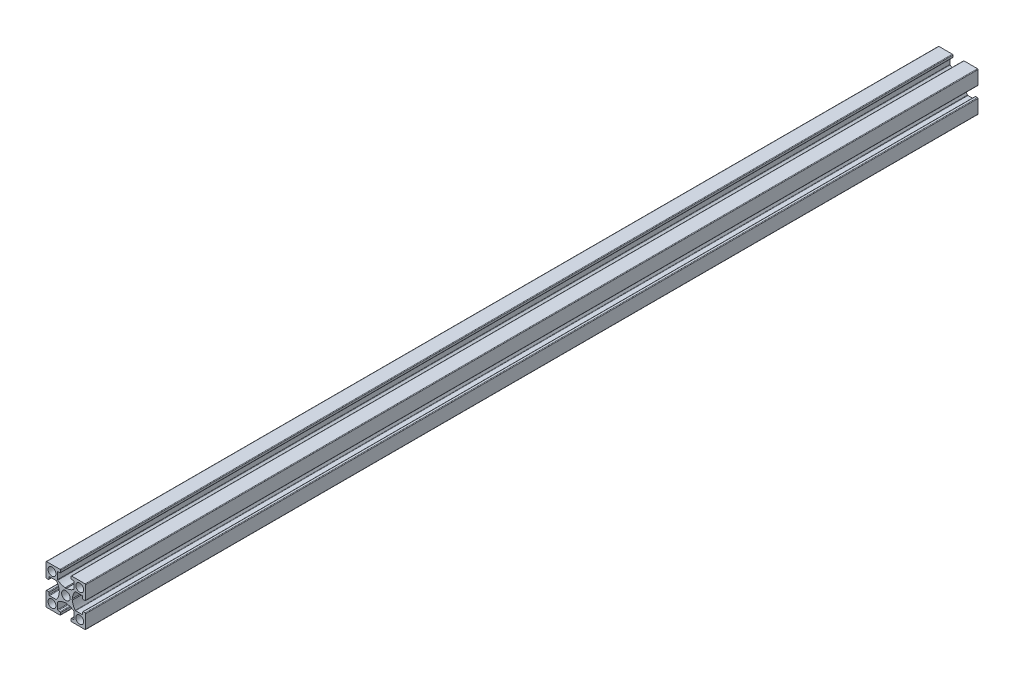
from build123d import *

# Parameters (mm, degrees)
MODEL_R         = 2.15
MODEL_R_2       = 2
EXTRUDE_1_DEPTH = 450


with BuildPart() as part:
    # Model → 보스-돌출1 (new body)
    with BuildSketch(Plane.XY):
        with BuildLine():
            Line((2307.763927197, 1192.134297913), (2307.763927197, 1195.391548465))
            ThreePointArc((2307.763927197, 1195.391548465), (2307.676059232, 1195.603680499), (2307.463927197, 1195.691548465))
            Line((2307.463927197, 1195.691548465), (2306.563927197, 1195.691548465))
            ThreePointArc((2306.563927197, 1195.691548465), (2306.351795163, 1195.779416431), (2306.263927197, 1195.991548465))
            Line((2306.263927197, 1195.991548465), (2306.263927197, 1196.891548465))
            ThreePointArc((2306.263927197, 1196.891548465), (2306.351795163, 1197.103680499), (2306.563927197, 1197.191548465))
            Line((2306.563927197, 1197.191548465), (2313.313927197, 1197.191548465))
            ThreePointArc((2313.313927197, 1197.191548465), (2313.526059232, 1197.103680499), (2313.613927197, 1196.891548465))
            Line((2313.613927197, 1196.891548465), (2313.613927197, 1190.141548465))
            ThreePointArc((2313.613927197, 1190.141548465), (2313.526059232, 1189.929416431), (2313.313927197, 1189.841548465))
            Line((2313.313927197, 1189.841548465), (2312.413927197, 1189.841548465))
            ThreePointArc((2312.413927197, 1189.841548465), (2312.201795163, 1189.929416431), (2312.113927197, 1190.141548465))
            Line((2312.113927197, 1190.141548465), (2312.113927197, 1191.041548465))
            ThreePointArc((2312.113927197, 1191.041548465), (2312.026059232, 1191.253680499), (2311.813927197, 1191.341548465))
            Line((2311.813927197, 1191.341548465), (2308.556676645, 1191.341548465))
            ThreePointArc((2308.556676645, 1191.341548465), (2308.426234796, 1191.311705686), (2308.321744595, 1191.228114625))
            ThreePointArc((2308.321744595, 1191.228114625), (2307.328306374, 1189.47356999), (2306.921204563, 1187.498825831))
            Line((2306.921204563, 1187.498825831), (2306.613927197, 1187.191548465))
            Line((2306.613927197, 1187.191548465), (2306.921204563, 1186.884271099))
            ThreePointArc((2306.921204563, 1186.884271099), (2307.328306374, 1184.90952694), (2308.321744595, 1183.154982305))
            ThreePointArc((2308.321744595, 1183.154982305), (2308.426234796, 1183.071391244), (2308.556676645, 1183.041548465))
            Line((2308.556676645, 1183.041548465), (2311.813927197, 1183.041548465))
            ThreePointArc((2311.813927197, 1183.041548465), (2312.026059232, 1183.129416431), (2312.113927197, 1183.341548465))
            Line((2312.113927197, 1183.341548465), (2312.113927197, 1184.241548465))
            ThreePointArc((2312.113927197, 1184.241548465), (2312.201795163, 1184.453680499), (2312.413927197, 1184.541548465))
            Line((2312.413927197, 1184.541548465), (2313.313927197, 1184.541548465))
            ThreePointArc((2313.313927197, 1184.541548465), (2313.526059232, 1184.453680499), (2313.613927197, 1184.241548465))
            Line((2313.613927197, 1184.241548465), (2313.613927197, 1177.491548465))
            ThreePointArc((2313.613927197, 1177.491548465), (2313.526059232, 1177.279416431), (2313.313927197, 1177.191548465))
            Line((2313.313927197, 1177.191548465), (2306.563927197, 1177.191548465))
            ThreePointArc((2306.563927197, 1177.191548465), (2306.351795163, 1177.279416431), (2306.263927197, 1177.491548465))
            Line((2306.263927197, 1177.491548465), (2306.263927197, 1178.391548465))
            ThreePointArc((2306.263927197, 1178.391548465), (2306.351795163, 1178.603680499), (2306.563927197, 1178.691548465))
            Line((2306.563927197, 1178.691548465), (2307.463927197, 1178.691548465))
            ThreePointArc((2307.463927197, 1178.691548465), (2307.676059232, 1178.779416431), (2307.763927197, 1178.991548465))
            Line((2307.763927197, 1178.991548465), (2307.763927197, 1182.248799017))
            ThreePointArc((2307.763927197, 1182.248799017), (2307.734084418, 1182.379240866), (2307.650493357, 1182.483731067))
            ThreePointArc((2307.650493357, 1182.483731067), (2305.895948722, 1183.477169289), (2303.921204563, 1183.884271099))
            Line((2303.921204563, 1183.884271099), (2303.613927197, 1184.191548465))
            Line((2303.613927197, 1184.191548465), (2303.306649831, 1183.884271099))
            ThreePointArc((2303.306649831, 1183.884271099), (2301.331905673, 1183.477169289), (2299.577361038, 1182.483731067))
            ThreePointArc((2299.577361038, 1182.483731067), (2299.493769977, 1182.379240866), (2299.463927197, 1182.248799017))
            Line((2299.463927197, 1182.248799017), (2299.463927197, 1178.991548465))
            ThreePointArc((2299.463927197, 1178.991548465), (2299.551795163, 1178.779416431), (2299.763927197, 1178.691548465))
            Line((2299.763927197, 1178.691548465), (2300.663927197, 1178.691548465))
            ThreePointArc((2300.663927197, 1178.691548465), (2300.876059232, 1178.603680499), (2300.963927197, 1178.391548465))
            Line((2300.963927197, 1178.391548465), (2300.963927197, 1177.491548465))
            ThreePointArc((2300.963927197, 1177.491548465), (2300.876059232, 1177.279416431), (2300.663927197, 1177.191548465))
            Line((2300.663927197, 1177.191548465), (2293.913927197, 1177.191548465))
            ThreePointArc((2293.913927197, 1177.191548465), (2293.701795163, 1177.279416431), (2293.613927197, 1177.491548465))
            Line((2293.613927197, 1177.491548465), (2293.613927197, 1184.241548465))
            ThreePointArc((2293.613927197, 1184.241548465), (2293.701795163, 1184.453680499), (2293.913927197, 1184.541548465))
            Line((2293.913927197, 1184.541548465), (2294.813927197, 1184.541548465))
            ThreePointArc((2294.813927197, 1184.541548465), (2295.026059232, 1184.453680499), (2295.113927197, 1184.241548465))
            Line((2295.113927197, 1184.241548465), (2295.113927197, 1183.341548465))
            ThreePointArc((2295.113927197, 1183.341548465), (2295.201795163, 1183.129416431), (2295.413927197, 1183.041548465))
            Line((2295.413927197, 1183.041548465), (2298.671177749, 1183.041548465))
            ThreePointArc((2298.671177749, 1183.041548465), (2298.801619599, 1183.071391244), (2298.906109799, 1183.154982305))
            ThreePointArc((2298.906109799, 1183.154982305), (2299.899548021, 1184.90952694), (2300.306649831, 1186.884271099))
            Line((2300.306649831, 1186.884271099), (2300.613927197, 1187.191548465))
            Line((2300.613927197, 1187.191548465), (2300.306649831, 1187.498825831))
            ThreePointArc((2300.306649831, 1187.498825831), (2299.899548021, 1189.47356999), (2298.906109799, 1191.228114625))
            ThreePointArc((2298.906109799, 1191.228114625), (2298.801619599, 1191.311705686), (2298.671177749, 1191.341548465))
            Line((2298.671177749, 1191.341548465), (2295.413927197, 1191.341548465))
            ThreePointArc((2295.413927197, 1191.341548465), (2295.201795163, 1191.253680499), (2295.113927197, 1191.041548465))
            Line((2295.113927197, 1191.041548465), (2295.113927197, 1190.141548465))
            ThreePointArc((2295.113927197, 1190.141548465), (2295.026059232, 1189.929416431), (2294.813927197, 1189.841548465))
            Line((2294.813927197, 1189.841548465), (2293.913927197, 1189.841548465))
            ThreePointArc((2293.913927197, 1189.841548465), (2293.701795163, 1189.929416431), (2293.613927197, 1190.141548465))
            Line((2293.613927197, 1190.141548465), (2293.613927197, 1196.891548465))
            ThreePointArc((2293.613927197, 1196.891548465), (2293.701795163, 1197.103680499), (2293.913927197, 1197.191548465))
            Line((2293.913927197, 1197.191548465), (2300.663927197, 1197.191548465))
            ThreePointArc((2300.663927197, 1197.191548465), (2300.876059232, 1197.103680499), (2300.963927197, 1196.891548465))
            Line((2300.963927197, 1196.891548465), (2300.963927197, 1195.991548465))
            ThreePointArc((2300.963927197, 1195.991548465), (2300.876059232, 1195.779416431), (2300.663927197, 1195.691548465))
            Line((2300.663927197, 1195.691548465), (2299.763927197, 1195.691548465))
            ThreePointArc((2299.763927197, 1195.691548465), (2299.551795163, 1195.603680499), (2299.463927197, 1195.391548465))
            Line((2299.463927197, 1195.391548465), (2299.463927197, 1192.134297913))
            ThreePointArc((2299.463927197, 1192.134297913), (2299.493769977, 1192.003856063), (2299.577361038, 1191.899365863))
            ThreePointArc((2299.577361038, 1191.899365863), (2301.331905673, 1190.905927641), (2303.306649831, 1190.498825831))
            Line((2303.306649831, 1190.498825831), (2303.613927197, 1190.191548465))
            Line((2303.613927197, 1190.191548465), (2303.921204563, 1190.498825831))
            ThreePointArc((2303.921204563, 1190.498825831), (2305.895948722, 1190.905927641), (2307.650493357, 1191.899365863))
            ThreePointArc((2307.650493357, 1191.899365863), (2307.734084418, 1192.003856063), (2307.763927197, 1192.134297913))
        make_face()
        with Locations((2303.613927197, 1187.191548465)):
            Circle(MODEL_R, mode=Mode.SUBTRACT)
        with Locations((2296.613927197, 1194.191548465)):
            Circle(MODEL_R_2, mode=Mode.SUBTRACT)
        with Locations((2296.613927197, 1180.191548465)):
            Circle(MODEL_R_2, mode=Mode.SUBTRACT)
        with Locations((2310.613927197, 1194.191548465)):
            Circle(MODEL_R_2, mode=Mode.SUBTRACT)
        with Locations((2310.613927197, 1180.191548465)):
            Circle(MODEL_R_2, mode=Mode.SUBTRACT)
    extrude(amount=EXTRUDE_1_DEPTH)


solid = part.part
